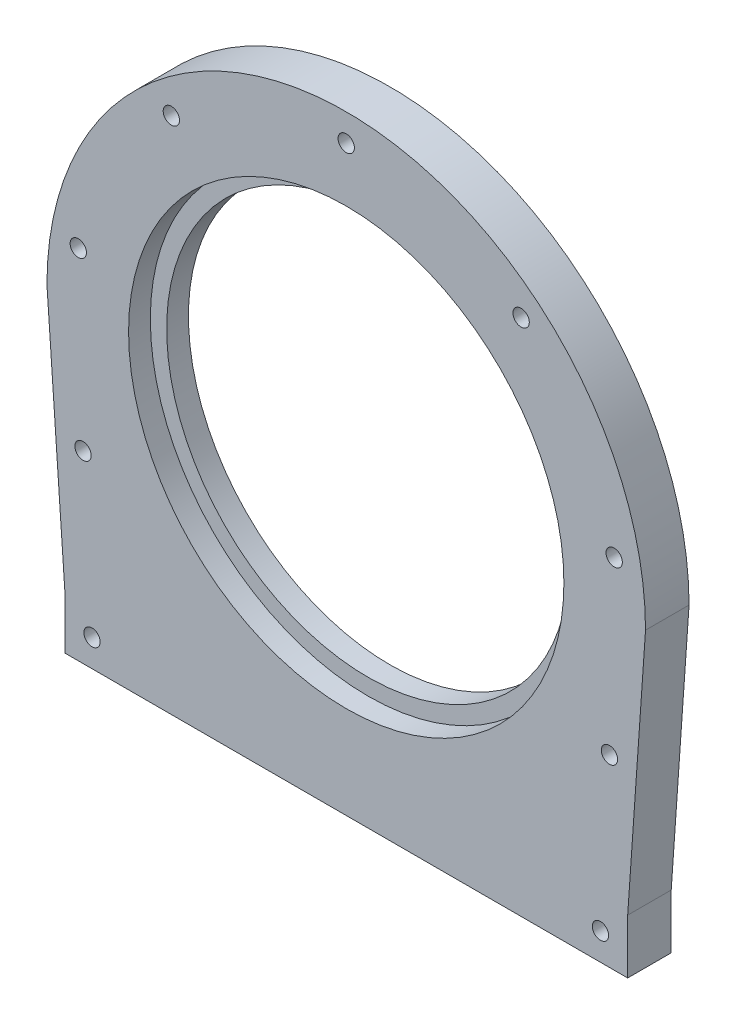
from build123d import *

# Parameters (mm, degrees)
SKETCH1_R           = 40
SKETCH1_R_2         = 1.5
SKETCH1_R_3         = 37
BOSS_EXTRUDE1_DEPTH = 8
SKETCH3_R           = 40
CUT_EXTRUDE1_DEPTH  = 4
SKETCH4_R           = 3
SKETCH4_R_2         = 1.5
CUT_EXTRUDE2_DEPTH  = 4


with BuildPart() as part:
    # Sketch1 → Boss-Extrude1 (new body)
    # profile 1 of 2: a face of its own
    with BuildSketch(Plane.XY):
        with BuildLine():
            Line((51.719126793, -47), (55, 0))
            ThreePointArc((55, 0), (0, 55), (-55, 0))
            Line((-55, 0), (-51.719126793, -47))
            Line((-51.719126793, -47), (-51.719126793, -57))
            Line((-51.719126793, -57), (-41.694792144, -57))
            Line((-41.694792144, -57), (41.694792144, -57))
            Line((41.694792144, -57), (51.719126793, -57))
            Line((51.719126793, -57), (51.719126793, -47))
        make_face()
        Circle(SKETCH1_R, mode=Mode.SUBTRACT)
        with Locations((46.719126793, -52)):
            Circle(SKETCH1_R_2, mode=Mode.SUBTRACT)
        with Locations((48.371701184, -23.151818224)):
            Circle(SKETCH1_R_2, mode=Mode.SUBTRACT)
        with Locations((49.240387651, 8.682408883)):
            Circle(SKETCH1_R_2, mode=Mode.SUBTRACT)
        with Locations((32.139380484, 38.302222156)):
            Circle(SKETCH1_R_2, mode=Mode.SUBTRACT)
        with Locations((0, 50)):
            Circle(SKETCH1_R_2, mode=Mode.SUBTRACT)
        with Locations((-32.139380484, 38.302222156)):
            Circle(SKETCH1_R_2, mode=Mode.SUBTRACT)
        with Locations((-49.240387651, 8.682408883)):
            Circle(SKETCH1_R_2, mode=Mode.SUBTRACT)
        with Locations((-48.371701184, -23.151818224)):
            Circle(SKETCH1_R_2, mode=Mode.SUBTRACT)
        with Locations((-46.719126793, -52)):
            Circle(SKETCH1_R_2, mode=Mode.SUBTRACT)
    # profile 2 of 2: a face of its own
    with BuildSketch(Plane.XY):
        Circle(SKETCH1_R)
        Circle(SKETCH1_R_3, mode=Mode.SUBTRACT)
    extrude(amount=BOSS_EXTRUDE1_DEPTH)

    # Sketch3 → Cut-Extrude1 (cut)
    with BuildSketch(Plane.XY.offset(8)):
        Circle(SKETCH3_R)
    extrude(amount=-CUT_EXTRUDE1_DEPTH, mode=Mode.SUBTRACT)

    # Sketch4 → Cut-Extrude2 (cut)
    # profile 1 of 9: a face of its own
    with BuildSketch(Plane(origin=(0, 0, 0), x_dir=(-1, 0, 0), z_dir=(0, 0, -1))):
        with Locations((-46.719126793, -52)):
            Circle(SKETCH4_R)
        with Locations((-46.719126793, -52)):
            Circle(SKETCH4_R_2, mode=Mode.SUBTRACT)
    # profile 2 of 9: a face of its own
    with BuildSketch(Plane(origin=(0, 0, 0), x_dir=(-1, 0, 0), z_dir=(0, 0, -1))):
        with Locations((-48.371701184, -23.151818224)):
            Circle(SKETCH4_R)
        with Locations((-48.371701184, -23.151818224)):
            Circle(SKETCH4_R_2, mode=Mode.SUBTRACT)
    # profile 3 of 9: a face of its own
    with BuildSketch(Plane(origin=(0, 0, 0), x_dir=(-1, 0, 0), z_dir=(0, 0, -1))):
        with Locations((-49.240387651, 8.682408883)):
            Circle(SKETCH4_R)
        with Locations((-49.240387651, 8.682408883)):
            Circle(SKETCH4_R_2, mode=Mode.SUBTRACT)
    # profile 4 of 9: a face of its own
    with BuildSketch(Plane(origin=(0, 0, 0), x_dir=(-1, 0, 0), z_dir=(0, 0, -1))):
        with Locations((-32.139380484, 38.302222156)):
            Circle(SKETCH4_R)
        with Locations((-32.139380484, 38.302222156)):
            Circle(SKETCH4_R_2, mode=Mode.SUBTRACT)
    # profile 5 of 9: a face of its own
    with BuildSketch(Plane(origin=(0, 0, 0), x_dir=(-1, 0, 0), z_dir=(0, 0, -1))):
        with Locations((0, 50)):
            Circle(SKETCH4_R)
        with Locations((0, 50)):
            Circle(SKETCH4_R_2, mode=Mode.SUBTRACT)
    # profile 6 of 9: a face of its own
    with BuildSketch(Plane(origin=(0, 0, 0), x_dir=(-1, 0, 0), z_dir=(0, 0, -1))):
        with Locations((32.139380484, 38.302222156)):
            Circle(SKETCH4_R)
        with Locations((32.139380484, 38.302222156)):
            Circle(SKETCH4_R_2, mode=Mode.SUBTRACT)
    # profile 7 of 9: a face of its own
    with BuildSketch(Plane(origin=(0, 0, 0), x_dir=(-1, 0, 0), z_dir=(0, 0, -1))):
        with Locations((49.240387651, 8.682408883)):
            Circle(SKETCH4_R)
        with Locations((49.240387651, 8.682408883)):
            Circle(SKETCH4_R_2, mode=Mode.SUBTRACT)
    # profile 8 of 9: a face of its own
    with BuildSketch(Plane(origin=(0, 0, 0), x_dir=(-1, 0, 0), z_dir=(0, 0, -1))):
        with Locations((48.371701184, -23.151818224)):
            Circle(SKETCH4_R)
        with Locations((48.371701184, -23.151818224)):
            Circle(SKETCH4_R_2, mode=Mode.SUBTRACT)
    # profile 9 of 9: a face of its own
    with BuildSketch(Plane(origin=(0, 0, 0), x_dir=(-1, 0, 0), z_dir=(0, 0, -1))):
        with Locations((46.719126793, -52)):
            Circle(SKETCH4_R)
        with Locations((46.719126793, -52)):
            Circle(SKETCH4_R_2, mode=Mode.SUBTRACT)
    extrude(amount=-CUT_EXTRUDE2_DEPTH, mode=Mode.SUBTRACT)


solid = part.part
